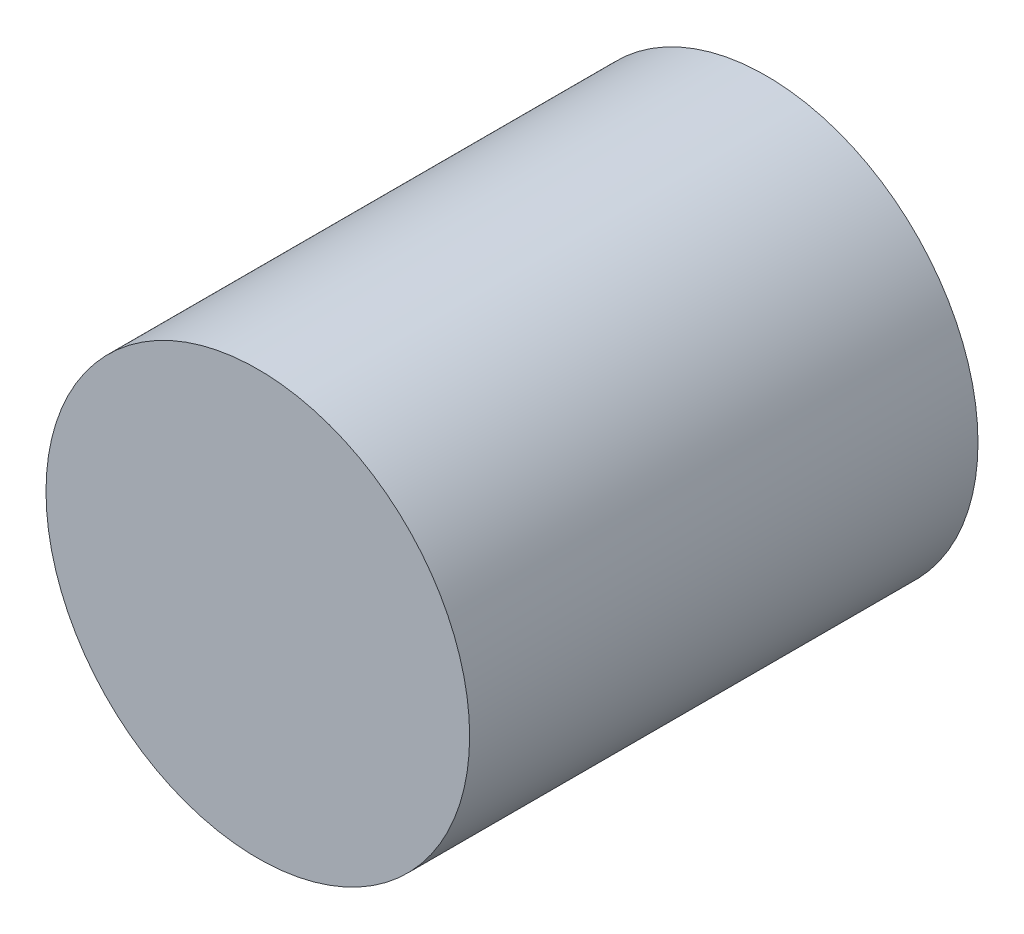
from build123d import *

# Parameters (mm, degrees)
SKETCH1_R           = 5
BOSS_EXTRUDE1_DEPTH = 12


with BuildPart() as part:
    # Sketch1 → Boss-Extrude1 (new body)
    with BuildSketch(Plane.XY):
        Circle(SKETCH1_R)
    extrude(amount=BOSS_EXTRUDE1_DEPTH)


solid = part.part
